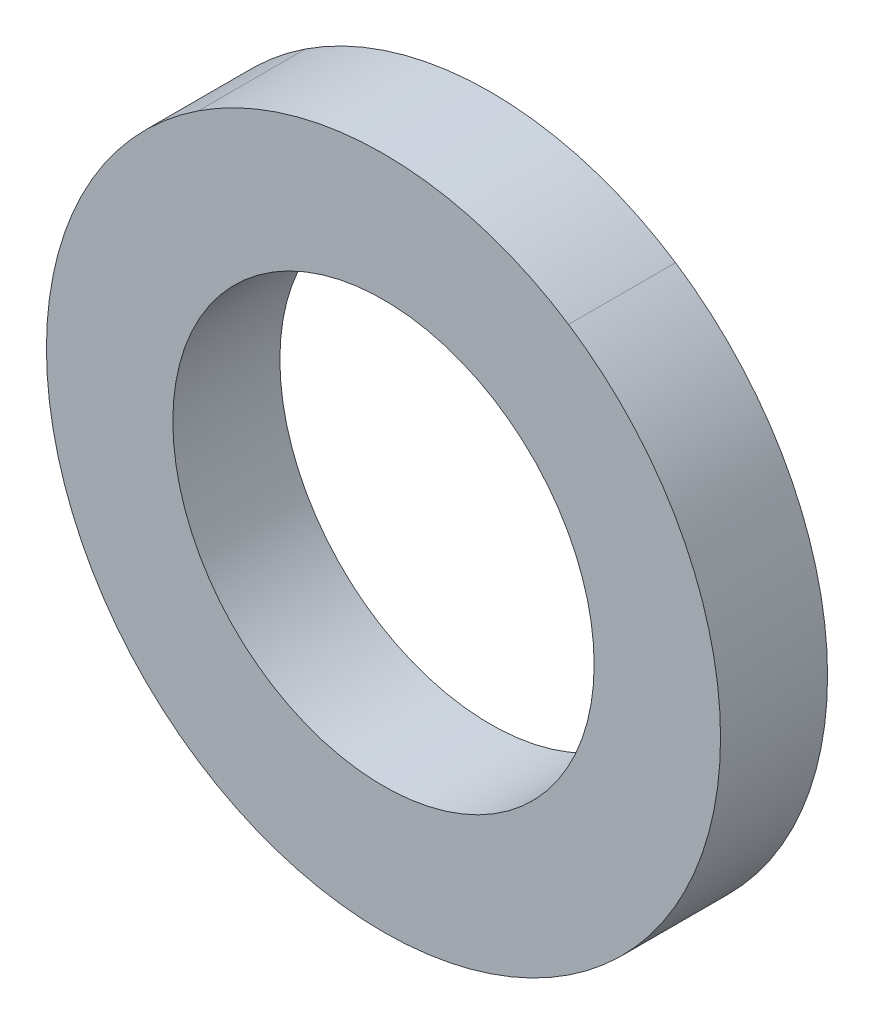
from build123d import *

# Parameters (mm, degrees)
SKETCH1_R           = 40
BOSS_EXTRUDE1_DEPTH = 12.7
SKETCH4_R           = 25
CUT_EXTRUDE1_DEPTH  = 101.6


with BuildPart() as part:
    # Sketch1 → Boss-Extrude1 (new body)
    with BuildSketch(Plane.XY):
        Circle(SKETCH1_R)
    extrude(amount=BOSS_EXTRUDE1_DEPTH)

    # Sketch4 → Cut-Extrude1 (cut)
    with BuildSketch(Plane.XY.offset(12.7)):
        Circle(SKETCH4_R)
    extrude(amount=-CUT_EXTRUDE1_DEPTH, mode=Mode.SUBTRACT)


solid = part.part
